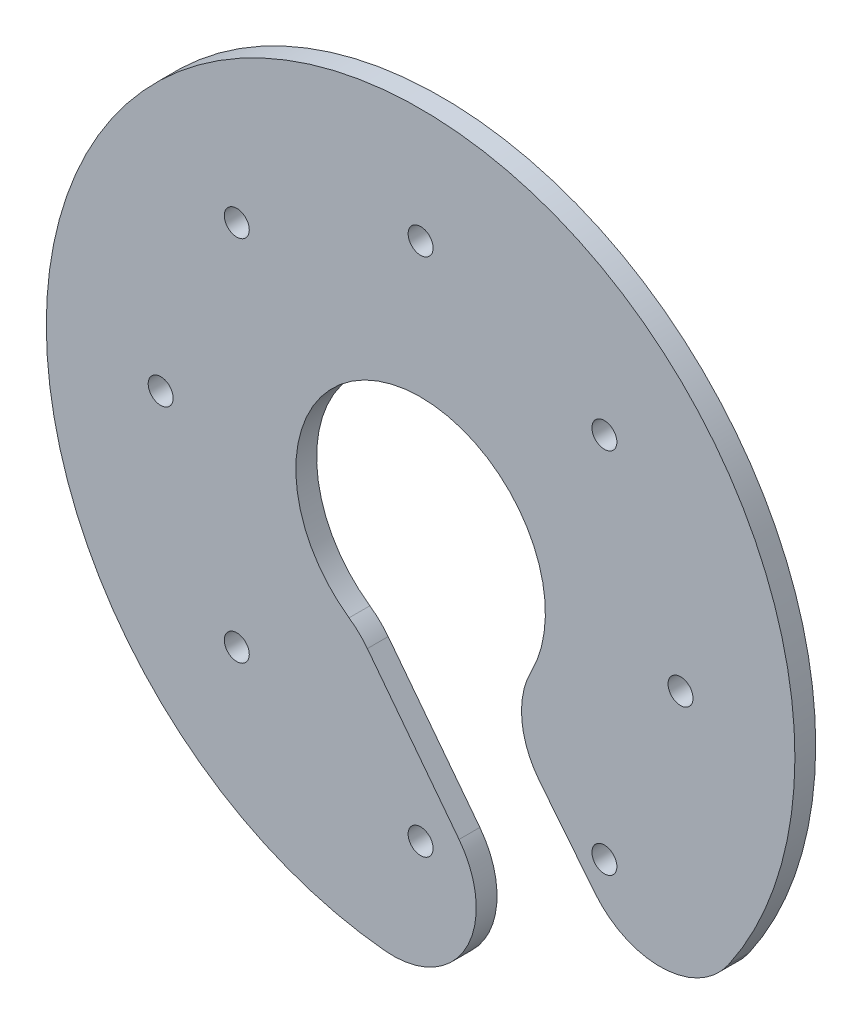
from build123d import *

# Parameters (mm, degrees)
SKETCH1_R           = 90
BOSS_EXTRUDE1_DEPTH = 5
CUT_EXTRUDE1_DEPTH  = 44
SKETCH3_R           = 3
CUT_EXTRUDE2_DEPTH  = 129
FILLET1_R           = 20


with BuildPart() as part:
    # Sketch1 → Boss-Extrude1 (new body)
    with BuildSketch(Plane.XY):
        Circle(SKETCH1_R)
    extrude(amount=BOSS_EXTRUDE1_DEPTH)

    # Sketch2 → Cut-Extrude1 (cut)
    with BuildSketch(Plane.XY.offset(5)):
        with BuildLine():
            Line((69.768328483, -87.081626915), (45.971435375, -105.349299959))
            Line((45.971435375, -105.349299959), (-14.920808105, -26.026322935))
            ThreePointArc((-14.920808105, -26.026322935), (-2.321306127, 29.91005747), (18.757736535, -23.412546211))
            Line((18.757736535, -23.412546211), (69.768328483, -87.081626915))
        make_face()
    extrude(amount=-CUT_EXTRUDE1_DEPTH, mode=Mode.SUBTRACT)

    # Sketch3 → Cut-Extrude2 (cut)
    with BuildSketch(Plane.XY.offset(5)):
        with Locations((62.5, 0)):
            Circle(SKETCH3_R)
        with Locations((44.194173824, -44.194173824)):
            Circle(SKETCH3_R)
        with Locations((0, -62.5)):
            Circle(SKETCH3_R)
        with Locations((-44.194173824, -44.194173824)):
            Circle(SKETCH3_R)
        with Locations((-62.5, 0)):
            Circle(SKETCH3_R)
        with Locations((-44.194173824, 44.194173824)):
            Circle(SKETCH3_R)
        with Locations((0, 62.5)):
            Circle(SKETCH3_R)
        with Locations((44.194173824, 44.194173824)):
            Circle(SKETCH3_R)
    extrude(amount=-CUT_EXTRUDE2_DEPTH, mode=Mode.SUBTRACT)

    # Fillet1
    fillet1_edges = [part.edges().sort_by_distance(p)[0] for p in [
        (-14.920808105, -26.026322935, 2.5),
        (56.273209604, -70.237638634, 2.5),
        (18.757736535, -23.412546211, 2.5),
        (30.18651872, -84.786638615, 2.5),
    ]]
    fillet(fillet1_edges, radius=FILLET1_R)


solid = part.part
